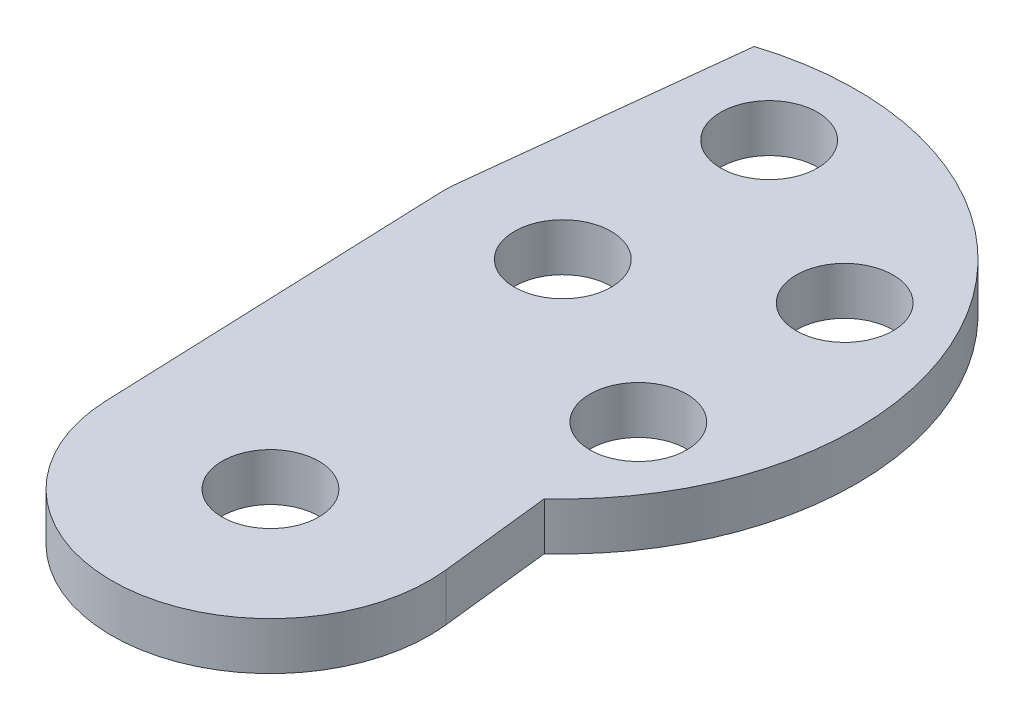
from build123d import *

# Parameters (mm, degrees)
SKETCH_1_R          = 7.5
SKETCH_1_R_2        = 3.05
EXTRUDE_1_DEPTH     = 3
SKETCH_2_R          = 3.05
EXTRUDE_2_DEPTH     = 3
SKETCH_3_R          = 3.05
CUT_EXTRUDE_1_DEPTH = 37.865769394


with BuildPart() as part:
    # 草图1 → 凸台-拉伸1 (new body)
    # profile 1 of 2: a face of its own
    with BuildSketch(Plane(origin=(0, 0, 0), x_dir=(1, 0, 0), z_dir=(0, 1, 0))):
        Circle(SKETCH_1_R)
    # profile 2 of 2: a face of its own
    with BuildSketch(Plane(origin=(0, 0, 0), x_dir=(1, 0, 0), z_dir=(0, 1, 0))):
        with BuildLine():
            ThreePointArc((18.5, 0), (10.931866676, 14.924620296), (-5.58046389, 17.638265866))
            Line((-5.58046389, 17.638265866), (-7.453841227, 0.830813432))
            ThreePointArc((-7.453841227, 0.830813432), (0.41604735, 7.488451416), (7.5, 0))
            ThreePointArc((7.5, 0), (4.104533282, -6.277165486), (-3.007415076, -6.870622574))
            Line((-3.007415076, -6.870622574), (12.484954374, -13.651956427))
            ThreePointArc((12.484954374, -13.651956427), (16.9295844, -7.45916698), (18.5, 0))
        make_face()
        with Locations(Location((11.258330249, -6.5, 0), (0, 0, 270))):
            Circle(SKETCH_1_R_2, mode=Mode.SUBTRACT)
        with Locations(Location((11.258330249, 6.5, 0), (0, 0, 270))):
            Circle(SKETCH_1_R_2, mode=Mode.SUBTRACT)
        with Locations(Location((0, 13, 0), (0, 0, 270))):
            Circle(SKETCH_1_R_2, mode=Mode.SUBTRACT)
    extrude(amount=EXTRUDE_1_DEPTH)

    # 草图2 → 凸台-拉伸2 (add, through all)
    with BuildSketch(Plane(origin=(0, 3, 0), x_dir=(1, 0, 0), z_dir=(0, 1, 0))):
        with BuildLine():
            ThreePointArc((-3.007415076, -6.870622574), (-6.197847944, -4.223349483), (-7.49455821, -0.285652289))
            Line((-7.49455821, -0.285652289), (-6.662072489, -22.1272861))
            ThreePointArc((-6.662072489, -22.1272861), (4.07930362, -31.718354527), (13.268273691, -20.6310382))
            Line((13.268273691, -20.6310382), (12.484954374, -13.651956427))
            Line((12.484954374, -13.651956427), (-3.007415076, -6.870622574))
        make_face()
        with Locations(Location((3.330671791, -21.746416381, 0), (0, 0, 270))):
            Circle(SKETCH_2_R, mode=Mode.SUBTRACT)
    extrude(amount=-EXTRUDE_2_DEPTH)

    # 草图3 → 切除-拉伸1 (cut, through all)
    with BuildSketch(Plane(origin=(0, 3, 0), x_dir=(1, 0, 0), z_dir=(0, 1, 0))):
        with Locations(Location((0, 0, 0), (0, 0, 270))):
            Circle(SKETCH_3_R)
    extrude(amount=-CUT_EXTRUDE_1_DEPTH, mode=Mode.SUBTRACT)


solid = part.part
